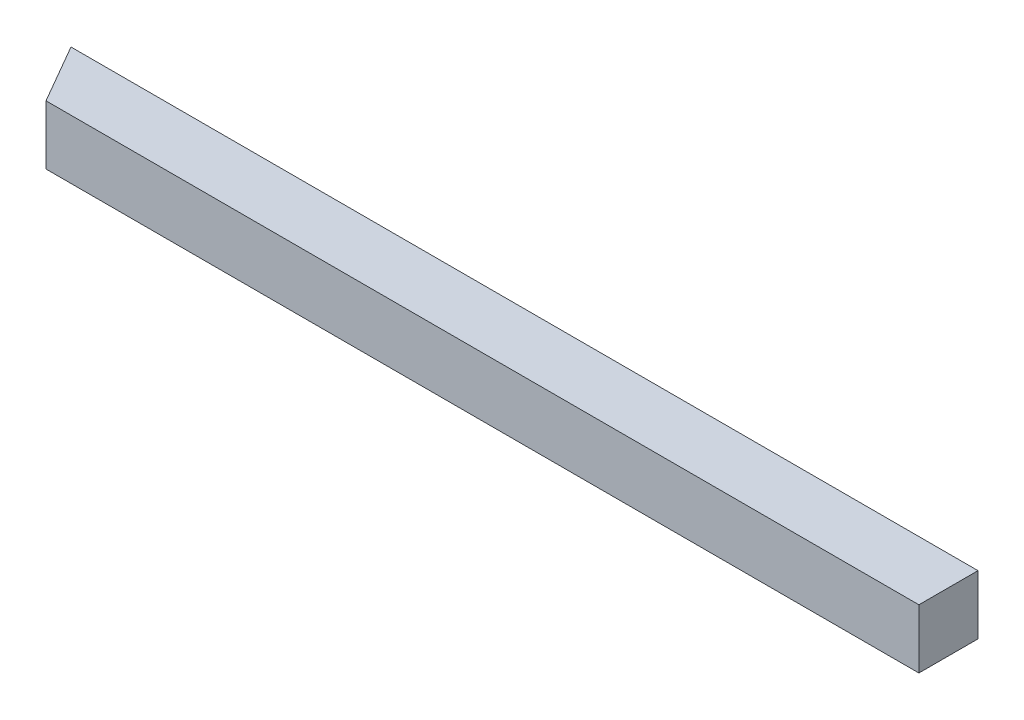
from build123d import *

# Parameters (mm, degrees)
EXTRUDE_1_DEPTH = 20


with BuildPart() as part:
    # 草图1 → 凸台-拉伸1 (new body)
    with BuildSketch(Plane(origin=(0, 0, 0), x_dir=(1, 0, 0), z_dir=(0, 1, 0))):
        Polygon((293.094010768, -200), (600, -200), (600, -220), (304.641016151, -220), align=None)
    extrude(amount=EXTRUDE_1_DEPTH)


solid = part.part
